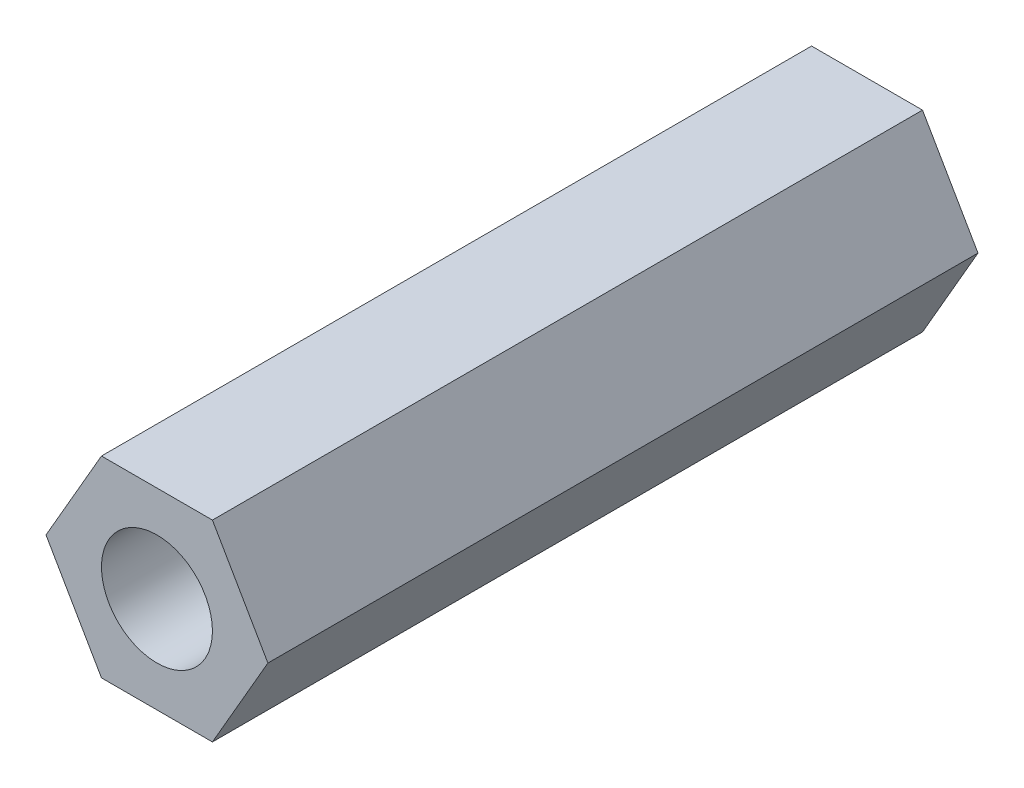
from build123d import *

# Parameters (mm, degrees)
EXTRUDE_1_DEPTH    = 16
HOLE_WIZARD_M3_1_D = 2.5


with BuildPart() as part:
    # 草图1 → 凸台-拉伸1 (new body)
    with BuildSketch(Plane.XY):
        Polygon((0, 0), (2.5, 0), (3.75, -2.165063509), (2.5, -4.330127019), (0, -4.330127019), (-1.25, -2.165063509), align=None)
    extrude(amount=EXTRUDE_1_DEPTH)

    # M3 螺纹孔1 (through all)
    with Locations(Plane.XY.offset(16)):
        with Locations((1.25, -2.165063509)):
            Hole(HOLE_WIZARD_M3_1_D / 2)


solid = part.part
